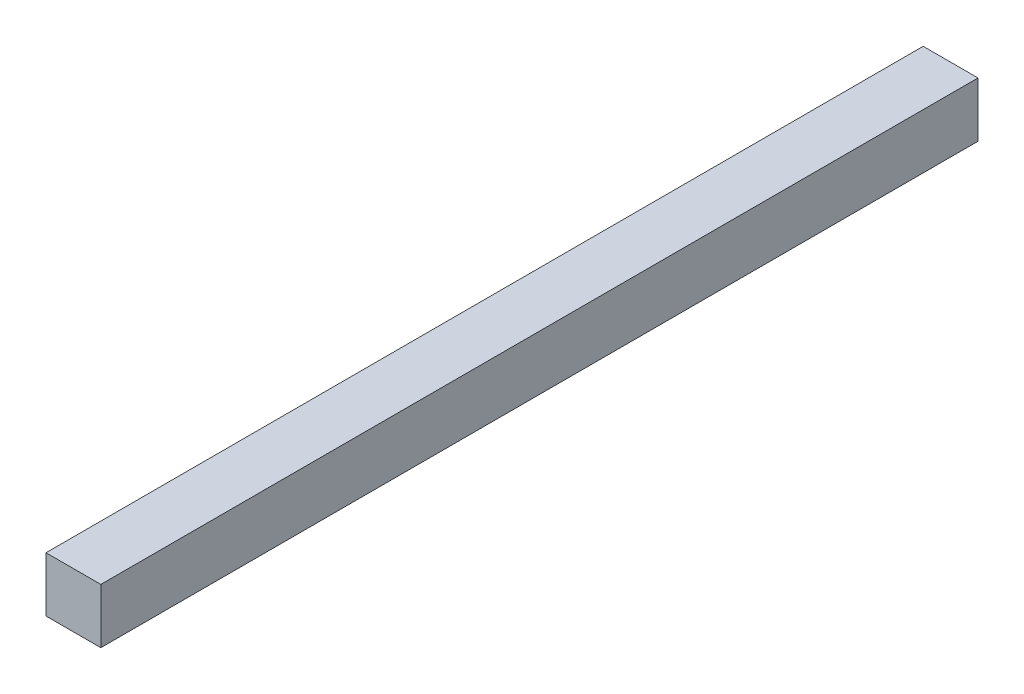
from build123d import *

# Parameters (mm, degrees)
SKETCH1_W           = 50
SKETCH1_H           = 50
BOSS_EXTRUDE1_DEPTH = 800


with BuildPart() as part:
    # Sketch1 → Boss-Extrude1 (new body)
    with BuildSketch(Plane.XY):
        with Locations((25, 25)):
            Rectangle(SKETCH1_W, SKETCH1_H)
    extrude(amount=BOSS_EXTRUDE1_DEPTH)


solid = part.part
